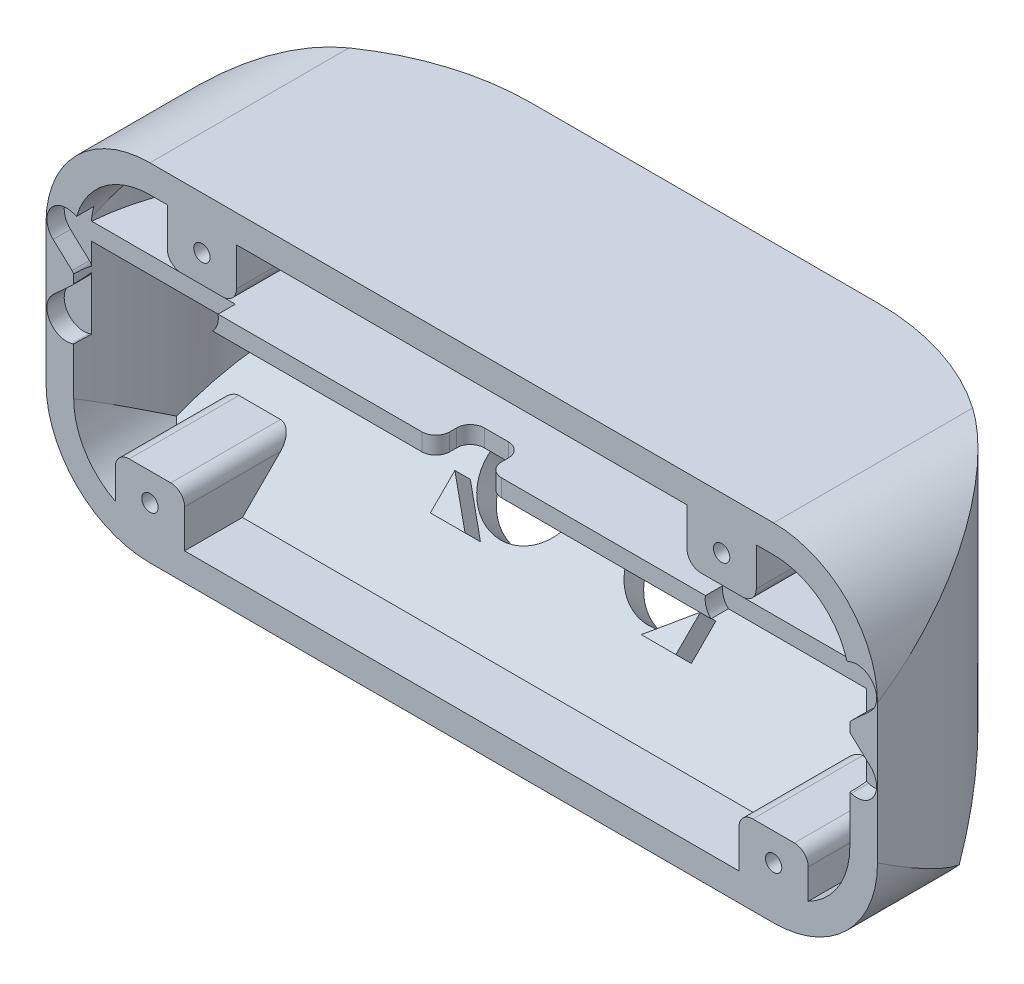
from build123d import *

# Parameters (mm, degrees)
BOSS_EXTRUDE2_DEPTH     = 31.75
CUT_EXTRUDE2_REACH      = 95.757
CUT_EXTRUDE3_DEPTH      = 94.75662659503067
CUT_EXTRUDE3_DEPTH_BACK = 94.75662659503067
SHELL2_T                = -5.08
BOSS_EXTRUDE3_REACH     = 95.757
SKETCH7_W               = 142.24
SKETCH7_H               = 3.1750000000000007
CUT_EXTRUDE4_REACH      = 101.361
FILLET1_R               = 2.54
SKETCH9_R               = 8.500000002
SKETCH9_R_2             = 8.500000001999997
CUT_EXTRUDE5_DEPTH      = 5.08
BOSS_EXTRUDE4_DEPTH     = 4
BOSS_EXTRUDE5_REACH     = 95.757
SKETCH11_W              = 12.70000000000001
SKETCH11_H              = 9.524999999999999
SKETCH11_R              = 1.5000000000000042
SKETCH11_W_2            = 12.700000000000003
SKETCH11_H_2            = 9.525000000000002
FILLET2_R               = 2.54
CUT_EXTRUDE6_DEPTH      = 3.175


with BuildPart() as part:
    # Sketch4 → Boss-Extrude2 (new, symmetric)
    with BuildSketch(Plane(origin=(0, 0, 0), x_dir=(1, 0, 0), z_dir=(0, 1, 0))):
        with BuildLine():
            Line((-76.2, 4.67e-15), (76.2, -4.67e-15))
            ThreePointArc((76.2, -4.67e-15), (63.18089642374204, 31.430896423742038), (31.75, 44.45))
            Line((31.75, 44.45), (-31.75, 44.45))
            ThreePointArc((-31.75, 44.45), (-63.18089642374204, 31.43089642374204), (-76.2, 4.67e-15))
        make_face()
    extrude(amount=BOSS_EXTRUDE2_DEPTH, both=True)

    # Sketch2 → Cut-Extrude2 (cut, up to next)
    with BuildSketch(Plane.XY, mode=Mode.PRIVATE) as cut_extrude2_sk1:
        with BuildLine():
            ThreePointArc((-76.19999999999996, 12.699999999999934), (-70.6203841816038, 26.17038418160375), (-57.15000000000004, 31.750000000000068))
            Line((-57.15000000000004, 31.75), (-76.2, 31.75))
            Line((-76.2, 31.75), (-76.2, 12.699999999999932))
        make_face()
    cut_extrude2_tool1 = extrude(cut_extrude2_sk1.sketch, amount=-CUT_EXTRUDE2_REACH, mode=Mode.PRIVATE) & part.part
    # Sketch2 → Cut-Extrude2 (cut, up to next)
    with BuildSketch(Plane.XY, mode=Mode.PRIVATE) as cut_extrude2_sk2:
        with BuildLine():
            ThreePointArc((-57.14999999999998, -31.749999999999932), (-70.6203841816037, -26.17038418160365), (-76.19999999999996, -12.699999999999935))
            Line((-76.2, -12.699999999999935), (-76.2, -31.75))
            Line((-76.2, -31.75), (-57.14999999999998, -31.75))
        make_face()
    cut_extrude2_tool2 = extrude(cut_extrude2_sk2.sketch, amount=-CUT_EXTRUDE2_REACH, mode=Mode.PRIVATE) & part.part
    # Sketch2 → Cut-Extrude2 (cut, up to next)
    with BuildSketch(Plane.XY, mode=Mode.PRIVATE) as cut_extrude2_sk3:
        with BuildLine():
            Line((76.2, -31.75), (76.2, -12.699999999999935))
            ThreePointArc((76.20000000000005, -12.699999999999937), (70.62038418160378, -26.17038418160367), (57.15000000000004, -31.74999999999993))
            Line((57.15000000000005, -31.75), (76.2, -31.75))
        make_face()
    cut_extrude2_tool3 = extrude(cut_extrude2_sk3.sketch, amount=-CUT_EXTRUDE2_REACH, mode=Mode.PRIVATE) & part.part
    # Sketch2 → Cut-Extrude2 (cut, up to next)
    with BuildSketch(Plane.XY, mode=Mode.PRIVATE) as cut_extrude2_sk4:
        with BuildLine():
            Line((76.2, 31.75), (57.15000000000005, 31.75))
            ThreePointArc((57.15000000000004, 31.750000000000068), (70.62038418160378, 26.1703841816038), (76.20000000000005, 12.700000000000065))
            Line((76.2, 12.700000000000067), (76.2, 31.75))
        make_face()
    cut_extrude2_tool4 = extrude(cut_extrude2_sk4.sketch, amount=-CUT_EXTRUDE2_REACH, mode=Mode.PRIVATE) & part.part
    add(cut_extrude2_tool1.solids().sort_by_distance((-71.944841, 27.494841, 0))[0], mode=Mode.SUBTRACT)
    add(cut_extrude2_tool2.solids().sort_by_distance((-71.944841, -27.494841, 0))[0], mode=Mode.SUBTRACT)
    add(cut_extrude2_tool3.solids().sort_by_distance((71.944841, -27.494841, 0))[0], mode=Mode.SUBTRACT)
    add(cut_extrude2_tool4.solids().sort_by_distance((71.944841, 27.494841, 0))[0], mode=Mode.SUBTRACT)

    # Sketch5 → Cut-Extrude3 (cut, two sides: drawn at the far end of the back side and taken through both)
    with BuildSketch(Plane(origin=(0, 0, 0), x_dir=(0, 0, -1), z_dir=(1, 0, 0)).offset(-CUT_EXTRUDE3_DEPTH_BACK)):
        Polygon((44.45, -31.75), (44.449999999999996, 0), (12.70000000000026, -31.75), align=None)
    extrude(amount=CUT_EXTRUDE3_DEPTH + CUT_EXTRUDE3_DEPTH_BACK, mode=Mode.SUBTRACT)

    # Shell2
    shell2_openings = [part.faces().sort_by_distance(p)[0] for p in [
        (0, 0, 0),
    ]]
    offset(amount=SHELL2_T, openings=shell2_openings)

    # Sketch7 → Boss-Extrude3 (add, up to next)
    with BuildSketch(Plane.XY, mode=Mode.PRIVATE) as boss_extrude3_sk1:
        with Locations((4.263e-14, 12.382500000000062)):
            Rectangle(SKETCH7_W, SKETCH7_H)
    boss_extrude3_tool1 = extrude(boss_extrude3_sk1.sketch, amount=-BOSS_EXTRUDE3_REACH, mode=Mode.PRIVATE) - part.part
    add(boss_extrude3_tool1.solids().sort_by_distance((0, 12.3825, 0))[0])

    # Sketch8 → Cut-Extrude4 (cut, up to next)
    with BuildSketch(Plane(origin=(0, 13.970000000000063, 0), x_dir=(1, 0, 0), z_dir=(0, 1, 0)), mode=Mode.PRIVATE) as cut_extrude4_sk1:
        Polygon((-4.762500000000003, 3.5e-15), (4.762500000000003, 3.5e-15), (4.7624999999999975, 6.350000000000003), (-4.762500000000003, 6.350000000000003), align=None)
    cut_extrude4_tool1 = extrude(cut_extrude4_sk1.sketch, amount=-CUT_EXTRUDE4_REACH, mode=Mode.PRIVATE) & part.part
    add(cut_extrude4_tool1.solids().sort_by_distance((0, 13.97, -3.175))[0], mode=Mode.SUBTRACT)

    # Fillet1
    fillet1_edges = [part.edges().sort_by_distance(p)[0] for p in [
        (4.762500000000003, 12.382500000000062, -3.5e-15),
        (4.7624999999999975, 12.382500000000062, -6.350000000000003),
        (-4.762500000000003, 12.382500000000062, -6.350000000000003),
        (-4.762500000000003, 12.382500000000062, -3.5e-15),
    ]]
    fillet(fillet1_edges, radius=FILLET1_R)

    # Sketch9 → Cut-Extrude5 (cut)
    with BuildSketch(Plane(origin=(0, 27.497255919571238, -71.94725591957103), x_dir=(1, 0, 0), z_dir=(0, 0.7071067811865446, 0.7071067811865505))):
        with Locations(Location((-13.50000000000002, -58.984067957991726, 0), (0, 0, 270))):
            Circle(SKETCH9_R)
        with Locations(Location((13.499999999999908, -58.98406795799174, 0), (0, 0, 270))):
            Circle(SKETCH9_R_2)
    extrude(amount=CUT_EXTRUDE5_DEPTH, mode=Mode.SUBTRACT)

    # Sketch10 → Boss-Extrude4 (add)
    with BuildSketch(Plane(origin=(0, -19.795691377579207, -17.47010372556566), x_dir=(1, 0, 0), z_dir=(0, 0.7071067811865446, 0.7071067811865505))):
        Polygon((-22.500000000000025, 22.97825951423413), (-16.150000000000027, 22.97825951423413), (-22.50000000000003, 16.62825951423413), align=None)
        Polygon((-22.50000000000002, 9.328259514234123), (-22.500000000000032, 2.9782595142341246), (-16.150000000000034, 2.978259514234097), align=None)
        Polygon((22.500000000000032, 2.9782595142341246), (16.150000000000034, 2.978259514234097), (22.50000000000002, 9.328259514234123), align=None)
        Polygon((22.500000000000025, 22.97825951423413), (22.50000000000003, 16.62825951423413), (16.150000000000027, 22.97825951423413), align=None)
    extrude(amount=BOSS_EXTRUDE4_DEPTH)

    # Sketch11 → Boss-Extrude5 (add, up to next)
    with BuildSketch(Plane.XY, mode=Mode.PRIVATE) as boss_extrude5_sk1:
        with Locations((-47.62500000000006, 21.907500000000063)):
            Rectangle(SKETCH11_W, SKETCH11_H)
        with Locations((-47.62500000000005, 22.225)):
            Circle(SKETCH11_R, mode=Mode.SUBTRACT)
    boss_extrude5_tool1 = extrude(boss_extrude5_sk1.sketch, amount=-BOSS_EXTRUDE5_REACH, mode=Mode.PRIVATE) - part.part
    # Sketch11 → Boss-Extrude5 (add, up to next)
    with BuildSketch(Plane.XY, mode=Mode.PRIVATE) as boss_extrude5_sk2:
        with Locations((-57.150000000000055, -21.907499999999924)):
            Rectangle(SKETCH11_W_2, SKETCH11_H)
        with Locations((-57.150000000000055, -22.224999999999998)):
            Circle(SKETCH11_R, mode=Mode.SUBTRACT)
    boss_extrude5_tool2 = extrude(boss_extrude5_sk2.sketch, amount=-BOSS_EXTRUDE5_REACH, mode=Mode.PRIVATE) - part.part
    # Sketch11 → Boss-Extrude5 (add, up to next)
    with BuildSketch(Plane.XY, mode=Mode.PRIVATE) as boss_extrude5_sk3:
        with Locations((57.150000000000055, -21.907499999999924)):
            Rectangle(SKETCH11_W_2, SKETCH11_H)
        with Locations(Location((57.150000000000055, -22.225, 0), (0, 0, 270))):
            Circle(SKETCH11_R, mode=Mode.SUBTRACT)
    boss_extrude5_tool3 = extrude(boss_extrude5_sk3.sketch, amount=-BOSS_EXTRUDE5_REACH, mode=Mode.PRIVATE) - part.part
    # Sketch11 → Boss-Extrude5 (add, up to next)
    with BuildSketch(Plane.XY, mode=Mode.PRIVATE) as boss_extrude5_sk4:
        with Locations((47.62500000000006, 21.907500000000034)):
            Rectangle(SKETCH11_W, SKETCH11_H_2)
        with Locations((47.62500000000005, 22.224999999999973)):
            Circle(SKETCH11_R, mode=Mode.SUBTRACT)
    boss_extrude5_tool4 = extrude(boss_extrude5_sk4.sketch, amount=-BOSS_EXTRUDE5_REACH, mode=Mode.PRIVATE) - part.part
    add(boss_extrude5_tool1.solids().sort_by_distance((-47.625, 26.51125, 0))[0])
    add(boss_extrude5_tool2.solids().sort_by_distance((-57.15, -26.51125, 0))[0])
    add(boss_extrude5_tool3.solids().sort_by_distance((50.95875, -21.9075, 0))[0])
    add(boss_extrude5_tool4.solids().sort_by_distance((41.43375, 21.9075, 0))[0])

    # Fillet2
    fillet2_edges = [part.edges().sort_by_distance(p)[0] for p in [
        (-41.27500000000005, 17.145000000000064, -19.100204678222692),
        (-53.97500000000005, 17.145000000000064, -16.248432809043454),
        (-63.50000000000006, -17.144999999999925, -10.06039755157246),
        (-50.800000000000054, -17.144999999999925, -10.06039755157246),
        (50.800000000000054, -17.144999999999925, -10.06039755157246),
        (63.50000000000006, -17.144999999999925, -10.06039755157246),
        (53.97500000000005, 17.145000000000035, -16.24843280904345),
        (41.27500000000005, 17.145000000000035, -19.100204678222696),
    ]]
    fillet(fillet2_edges, radius=FILLET2_R)

    # Sketch13 → Cut-Extrude6 (cut)
    with BuildSketch(Plane.XY):
        with BuildLine():
            Line((71.42382205048372, 7.515572768580492), (74.88495472034906, 10.71598909777478))
            ThreePointArc((74.88495472034906, 10.71598909777478), (75.55622178905878, 15.143749999999986), (71.38603483149339, 16.77629611688605))
            Line((71.38603483149339, 16.77629611688605), (66.88382665279191, 15.379075463511551))
            ThreePointArc((66.88382665279191, 15.379075463511551), (65.61954792690663, 15.520426012510804), (64.86499539769174, 16.544648232092044))
            Line((64.86499539769174, 16.544648232092044), (63.823919888855634, 21.14228521466087))
            ThreePointArc((63.823919888855634, 21.14228521466087), (60.32499999999995, 23.93750000000001), (56.82608011114428, 21.142285214660863))
            Line((56.82608011114428, 21.142285214660863), (55.78500460230816, 16.544648232092076))
            ThreePointArc((55.78500460230816, 16.544648232092076), (55.03045207309327, 15.520426012510859), (53.76617334720802, 15.379075463511576))
            Line((53.76617334720802, 15.379075463511576), (49.26396516850654, 16.77629611688608))
            ThreePointArc((49.26396516850654, 16.77629611688608), (45.09377821094111, 15.143750000000004), (45.76504527965087, 10.71598909777479))
            Line((45.76504527965087, 10.71598909777479), (49.226177949516234, 7.515572768580496))
            ThreePointArc((49.226177949516234, 7.515572768580496), (49.735904146186606, 6.350000000000008), (49.226177949516234, 5.184427231419518))
            Line((49.226177949516234, 5.184427231419518), (45.76504527965087, 1.9840109022251986))
            ThreePointArc((45.76504527965087, 1.9840109022251986), (45.093778210941146, -2.443749999999981), (49.26396516850652, -4.076296116886075))
            Line((49.26396516850652, -4.076296116886075), (53.766173347208, -2.6790754635115652))
            ThreePointArc((53.766173347208, -2.6790754635115652), (55.030452073093265, -2.820426012510831), (55.785004602308156, -3.8446482320920548))
            Line((55.785004602308156, -3.8446482320920548), (56.82608011114428, -8.442285214660867))
            ThreePointArc((56.82608011114428, -8.442285214660867), (60.32499999999995, -11.237499999999994), (63.823919888855606, -8.442285214660858))
            Line((63.823919888855606, -8.442285214660858), (64.86499539769174, -3.844648232092041))
            ThreePointArc((64.86499539769174, -3.844648232092041), (65.61954792690663, -2.82042601251084), (66.88382665279188, -2.6790754635115688))
            Line((66.88382665279188, -2.6790754635115688), (71.38603483149336, -4.076296116886077))
            ThreePointArc((71.38603483149336, -4.076296116886077), (75.55622178905878, -2.4437500000000174), (74.88495472034906, 1.9840109022251986))
            Line((74.88495472034906, 1.9840109022251986), (71.42382205048372, 5.1844272314194795))
            ThreePointArc((71.42382205048372, 5.1844272314194795), (70.91409585381334, 6.349999999999985), (71.42382205048372, 7.515572768580492))
        make_face()
        with BuildLine():
            Line((-66.88382665279191, 15.379075463511523), (-71.38603483149339, 16.776296116886023))
            ThreePointArc((-71.38603483149339, 16.776296116886023), (-75.55622178905878, 15.143749999999958), (-74.88495472034906, 10.715989097774752))
            Line((-74.88495472034906, 10.715989097774752), (-71.42382205048372, 7.515572768580465))
            ThreePointArc((-71.42382205048372, 7.515572768580465), (-70.91409585381334, 6.349999999999967), (-71.42382205048372, 5.184427231419465))
            Line((-71.42382205048372, 5.184427231419465), (-74.88495472034906, 1.9840109022251848))
            ThreePointArc((-74.88495472034906, 1.9840109022251848), (-75.55622178905878, -2.4437500000000307), (-71.38603483149336, -4.076296116886091))
            Line((-71.38603483149336, -4.076296116886091), (-66.88382665279188, -2.679075463511583))
            ThreePointArc((-66.88382665279188, -2.679075463511583), (-65.61954792690663, -2.820426012510854), (-64.86499539769174, -3.8446482320920548))
            Line((-64.86499539769174, -3.8446482320920548), (-63.823919888855606, -8.442285214660872))
            ThreePointArc((-63.823919888855606, -8.442285214660872), (-60.324999999999946, -11.237500000000008), (-56.82608011114428, -8.44228521466088))
            Line((-56.82608011114428, -8.44228521466088), (-55.785004602308156, -3.8446482320920685))
            ThreePointArc((-55.785004602308156, -3.8446482320920685), (-55.030452073093265, -2.820426012510845), (-53.766173347208, -2.6790754635115794))
            Line((-53.766173347208, -2.6790754635115794), (-49.26396516850652, -4.076296116886089))
            ThreePointArc((-49.26396516850652, -4.076296116886089), (-45.093778210941146, -2.443749999999996), (-45.76504527965087, 1.9840109022251848))
            Line((-45.76504527965087, 1.9840109022251848), (-49.226177949516234, 5.1844272314195035))
            ThreePointArc((-49.226177949516234, 5.1844272314195035), (-49.735904146186606, 6.349999999999988), (-49.226177949516234, 7.515572768580468))
            Line((-49.226177949516234, 7.515572768580468), (-45.76504527965087, 10.715989097774763))
            ThreePointArc((-45.76504527965087, 10.715989097774763), (-45.09377821094111, 15.143749999999976), (-49.26396516850654, 16.77629611688605))
            Line((-49.26396516850654, 16.77629611688605), (-53.76617334720802, 15.379075463511548))
            ThreePointArc((-53.76617334720802, 15.379075463511548), (-55.03045207309327, 15.52042601251083), (-55.78500460230816, 16.544648232092047))
            Line((-55.78500460230816, 16.544648232092047), (-56.82608011114428, 21.142285214660834))
            ThreePointArc((-56.82608011114428, 21.142285214660834), (-60.32499999999995, 23.937499999999982), (-63.823919888855634, 21.14228521466084))
            Line((-63.823919888855634, 21.14228521466084), (-64.86499539769174, 16.544648232092015))
            ThreePointArc((-64.86499539769174, 16.544648232092015), (-65.61954792690663, 15.520426012510775), (-66.88382665279191, 15.379075463511523))
        make_face()
    extrude(amount=-CUT_EXTRUDE6_DEPTH, mode=Mode.SUBTRACT)


solid = part.part
